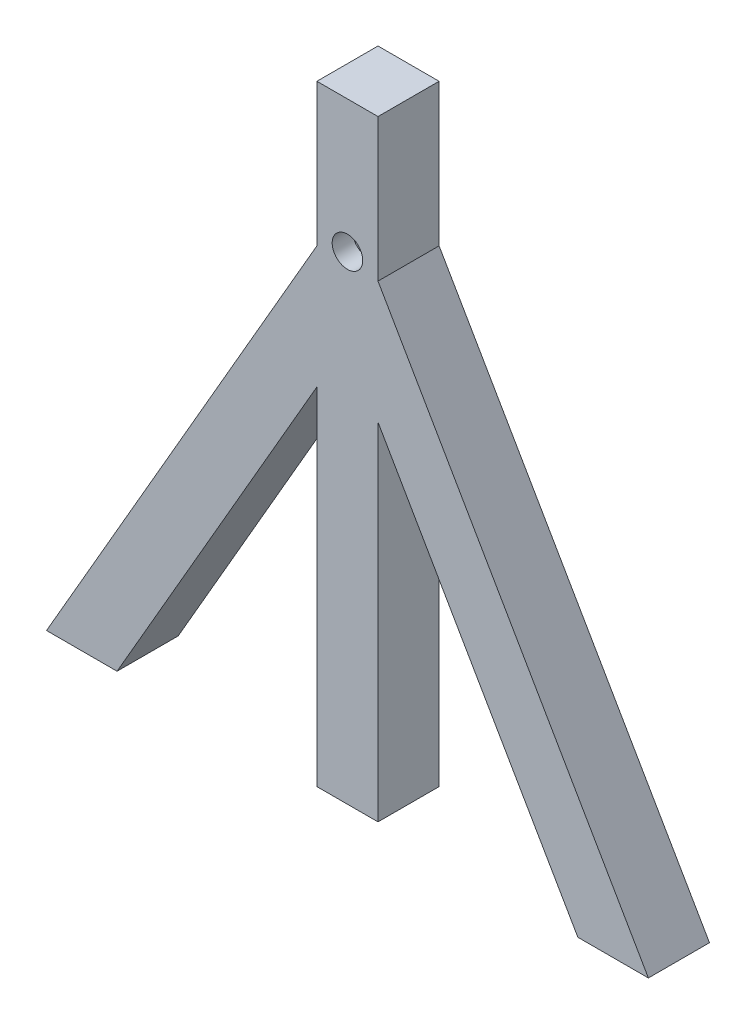
from build123d import *

# Parameters (mm, degrees)
BOSS_EXTRUDE1_DEPTH = 30
SKETCH2_R           = 7.5
CUT_EXTRUDE1_DEPTH  = 10


with BuildPart() as part:
    # Sketch1 → Boss-Extrude1 (new body)
    with BuildSketch(Plane.XY):
        Polygon((-15, 20), (-113.149545762, -150), (-147.790561914, -150), (-15, 80), (-15, 150), (15, 150), (15, 80), (147.790561914, -150), (113.149545762, -150), (15, 20), (15, -150), (-15, -150), align=None)
    extrude(amount=BOSS_EXTRUDE1_DEPTH)

    # Sketch2 → Cut-Extrude1 (cut)
    with BuildSketch(Plane.XY.offset(30)):
        with Locations((0, 85)):
            Circle(SKETCH2_R)
    extrude(amount=-CUT_EXTRUDE1_DEPTH, mode=Mode.SUBTRACT)


solid = part.part
